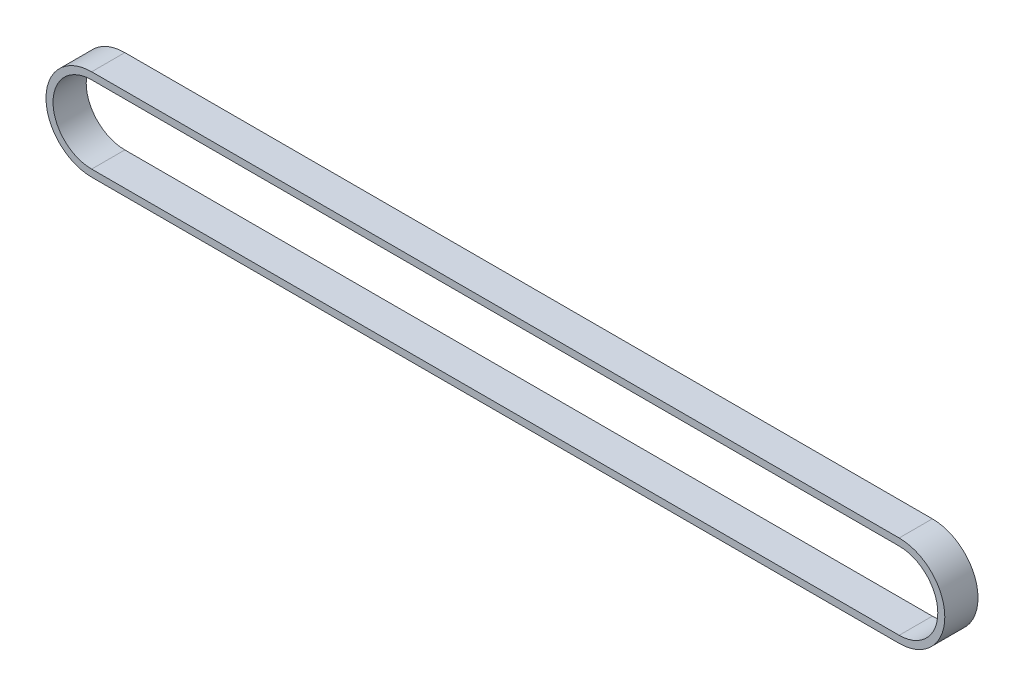
from build123d import *

# Parameters (mm, degrees)
BOSS_EXTRUDE1_DEPTH = 15


with BuildPart() as part:
    # Sketch1 → Boss-Extrude1 (new body)
    with BuildSketch(Plane.XY):
        with BuildLine():
            Line((0, 20.6375), (364.998, 20.6375))
            ThreePointArc((364.998, 20.6375), (385.6355, 0), (364.998, -20.6375))
            Line((364.998, -20.6375), (0, -20.6375))
            ThreePointArc((0, -20.6375), (-20.6375, 0), (0, 20.6375))
        make_face()
        with BuildLine():
            Line((0, 17.4625), (364.998, 17.4625))
            ThreePointArc((364.998, 17.4625), (382.4605, 0), (364.998, -17.4625))
            Line((364.998, -17.4625), (0, -17.4625))
            ThreePointArc((0, -17.4625), (-17.4625, 0), (0, 17.4625))
        make_face(mode=Mode.SUBTRACT)
    extrude(amount=BOSS_EXTRUDE1_DEPTH)


solid = part.part
